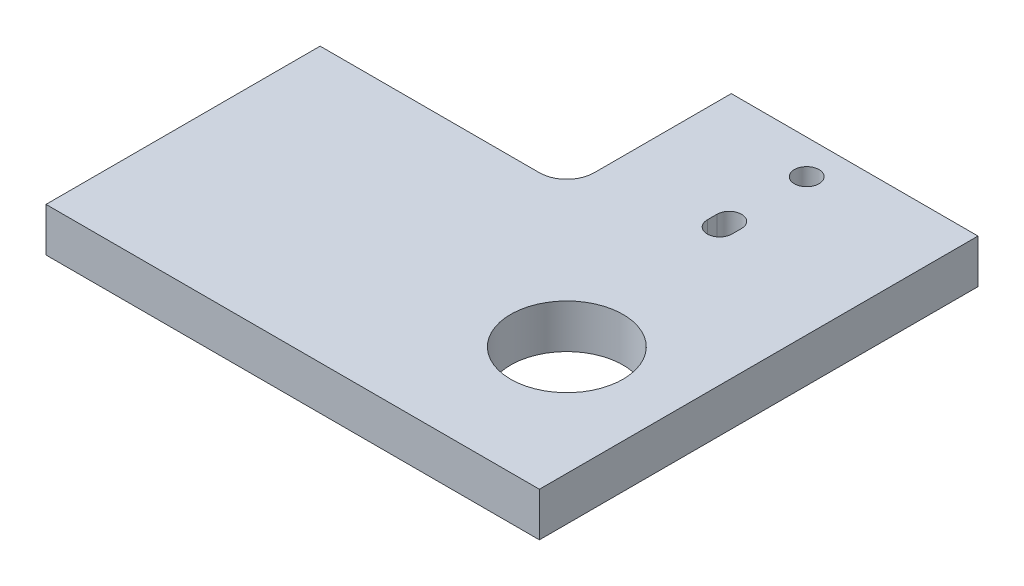
from build123d import *

# Parameters (mm, degrees)
SKETCH1_R           = 2.05
BOSS_EXTRUDE1_DEPTH = 1.6
SKETCH2_R           = 0.45
CUT_EXTRUDE1_DEPTH  = 19.935680606
FILLET1_R           = 1


with BuildPart() as part:
    # Sketch1 → Boss-Extrude1 (new body)
    with BuildSketch(Plane(origin=(0, 0, 0), x_dir=(1, 0, 0), z_dir=(0, 1, 0))):
        Polygon((1, 10), (1, 16), (10, 16), (10, 8), (10, 0), (0, 0), (-8, 0), (-8, 10), align=None)
        with Locations(Location((6, 5, 0), (0, 0, 270))):
            Circle(SKETCH1_R, mode=Mode.SUBTRACT)
    extrude(amount=BOSS_EXTRUDE1_DEPTH)

    # Sketch2 → Cut-Extrude1 (cut, through all)
    with BuildSketch(Plane(origin=(0, 1.6, 0), x_dir=(1, 0, 0), z_dir=(0, 1, 0))):
        with Locations(Location((5, 14.75, 0), (0, 0, 270))):
            Circle(SKETCH2_R)
        with BuildLine():
            Line((4.55, 11.575), (4.55, 11.925))
            ThreePointArc((4.55, 11.925), (5, 12.375), (5.45, 11.925))
            Line((5.45, 11.925), (5.45, 11.575))
            ThreePointArc((5.45, 11.575), (5, 11.125), (4.55, 11.575))
        make_face()
    extrude(amount=-CUT_EXTRUDE1_DEPTH, mode=Mode.SUBTRACT)

    # Fillet1
    fillet1_edges = [part.edges().sort_by_distance(p)[0] for p in [
        (1, 0.8, -10),
    ]]
    fillet(fillet1_edges, radius=FILLET1_R)


solid = part.part
